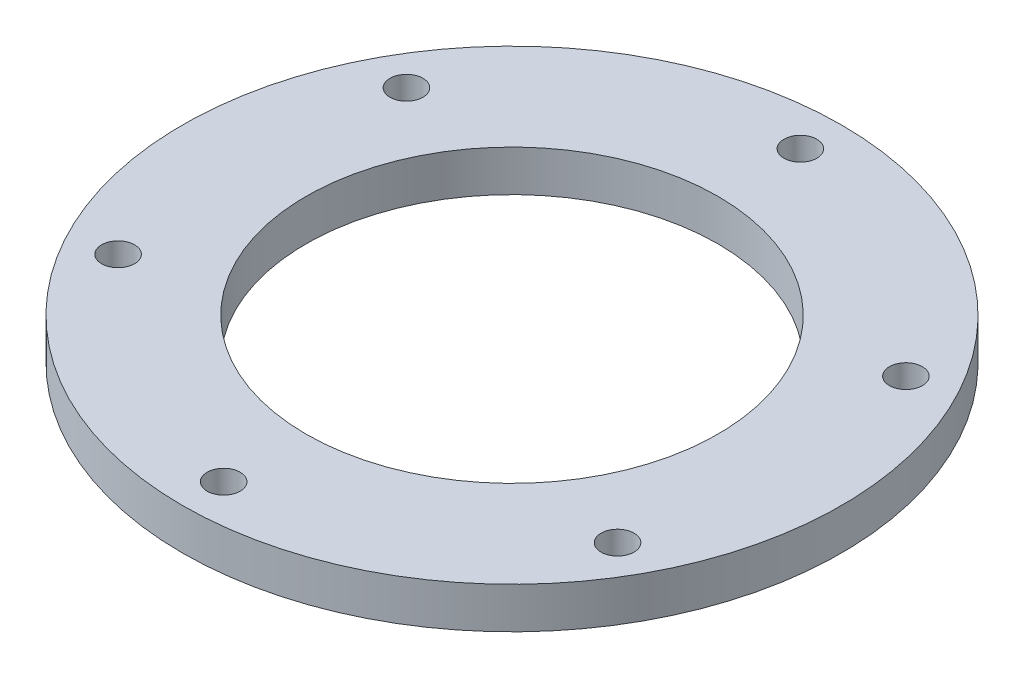
from build123d import *

# Parameters (mm, degrees)
SKETCH_1_R      = 40
SKETCH_1_R_2    = 25
SKETCH_1_R_3    = 2
EXTRUDE_1_DEPTH = 5


with BuildPart() as part:
    # 草图1 → 凸台-拉伸1 (new body)
    with BuildSketch(Plane(origin=(0, 0, 0), x_dir=(1, 0, 0), z_dir=(0, 1, 0))):
        with Locations(Location((0, 0, 0), (0, 0, 270))):
            Circle(SKETCH_1_R)
        with Locations(Location((0, 0, 0), (0, 0, 270))):
            Circle(SKETCH_1_R_2, mode=Mode.SUBTRACT)
        with Locations(Location((0, 35, 0), (0, 0, 270))):
            Circle(SKETCH_1_R_3, mode=Mode.SUBTRACT)
        with Locations(Location((30.310889132, 17.5, 0), (0, 0, 270))):
            Circle(SKETCH_1_R_3, mode=Mode.SUBTRACT)
        with Locations(Location((30.310889132, -17.5, 0), (0, 0, 270))):
            Circle(SKETCH_1_R_3, mode=Mode.SUBTRACT)
        with Locations(Location((0, -35, 0), (0, 0, 270))):
            Circle(SKETCH_1_R_3, mode=Mode.SUBTRACT)
        with Locations(Location((-30.310889132, -17.5, 0), (0, 0, 270))):
            Circle(SKETCH_1_R_3, mode=Mode.SUBTRACT)
        with Locations(Location((-30.310889132, 17.5, 0), (0, 0, 270))):
            Circle(SKETCH_1_R_3, mode=Mode.SUBTRACT)
    extrude(amount=EXTRUDE_1_DEPTH)


solid = part.part
